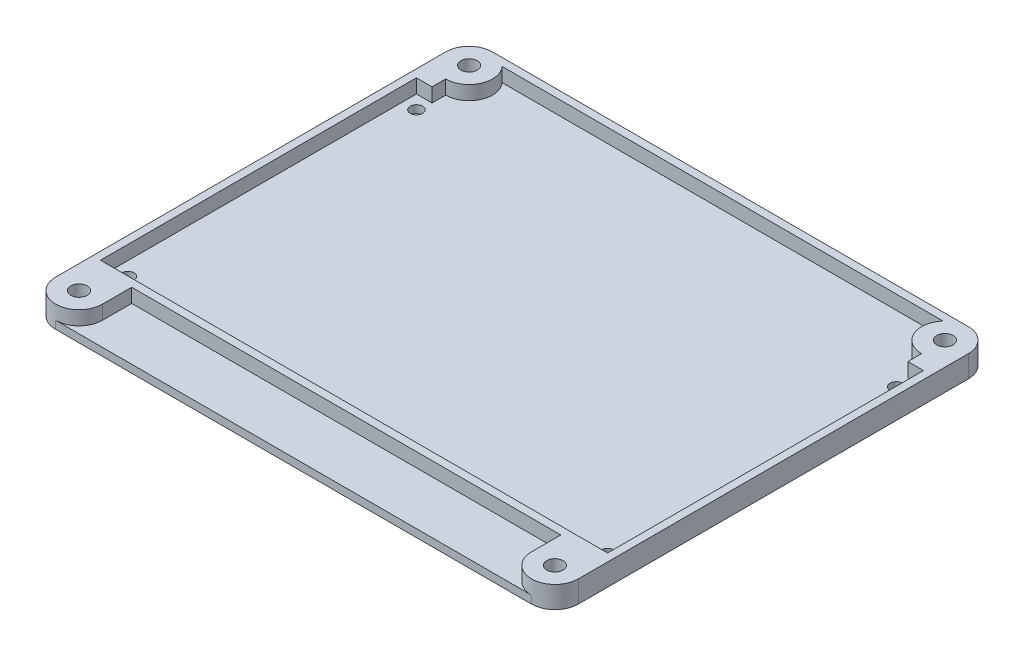
from build123d import *

# Parameters (mm, degrees)
SKETCH_1_W      = 129
SKETCH_1_H      = 80
SKETCH_1_R      = 1.6
EXTRUDE_1_DEPTH = 2
SKETCH_2_R      = 2.1
SKETCH_2_W      = 129
SKETCH_2_H      = 80
EXTRUDE_2_DEPTH = 2
EXTRUDE_START   = 3.6
SKETCH_3_R      = 2.1
EXTRUDE_3_DEPTH = 3.6
SKETCH_4_R      = 1.6
EXTRUDE_4_DEPTH = 3


with BuildPart() as part:
    # 草图1 → 凸台-拉伸1 (new body)
    with BuildSketch(Plane(origin=(0, 0, 0), x_dir=(1, 0, 0), z_dir=(0, 1, 0))):
        with Locations((96.776260997, 40)):
            Rectangle(SKETCH_1_W, SKETCH_1_H)
        with Locations(Location((35.276260997, 77, 0), (0, 0, 270))):
            Circle(SKETCH_1_R, mode=Mode.SUBTRACT)
        with Locations(Location((158.276260997, 77, 0), (0, 0, 270))):
            Circle(SKETCH_1_R, mode=Mode.SUBTRACT)
        with Locations(Location((158.276260997, 3, 0), (0, 0, 270))):
            Circle(SKETCH_1_R, mode=Mode.SUBTRACT)
        with Locations(Location((35.276260997, 3, 0), (0, 0, 270))):
            Circle(SKETCH_1_R, mode=Mode.SUBTRACT)
    extrude(amount=EXTRUDE_1_DEPTH)

    # 草图2 → 凸台-拉伸2 (add)
    with BuildSketch(Plane(origin=(0, 2, 0), x_dir=(1, 0, 0), z_dir=(0, 1, 0))):
        with BuildLine():
            Line((35.776260997, 96), (157.776260997, 96))
            ThreePointArc((157.776260997, 96), (162.018901684, 94.242640687), (163.776260997, 90))
            Line((163.776260997, 90), (163.776260997, -10))
            ThreePointArc((163.776260997, -10), (162.018901684, -14.242640687), (157.776260997, -16))
            Line((157.776260997, -16), (35.776260997, -16))
            ThreePointArc((35.776260997, -16), (31.53362031, -14.242640687), (29.776260997, -10))
            Line((29.776260997, -10), (29.776260997, 90))
            ThreePointArc((29.776260997, 90), (31.53362031, 94.242640687), (35.776260997, 96))
        make_face()
        with Locations(Location((35.776260997, -10, 0), (0, 0, 270))):
            Circle(SKETCH_2_R, mode=Mode.SUBTRACT)
        with Locations(Location((157.776260997, -10, 0), (0, 0, 90))):
            Circle(SKETCH_2_R, mode=Mode.SUBTRACT)
        with Locations(Location((157.776260997, 90, 0), (0, 0, 270))):
            Circle(SKETCH_2_R, mode=Mode.SUBTRACT)
        with Locations(Location((35.776260997, 90, 0), (0, 0, 90))):
            Circle(SKETCH_2_R, mode=Mode.SUBTRACT)
        with Locations((96.776260997, 40)):
            Rectangle(SKETCH_2_W, SKETCH_2_H, mode=Mode.SUBTRACT)
    extrude(amount=-EXTRUDE_2_DEPTH)

    # 草图3 → 凸台-拉伸3 (add)
    with BuildSketch(Plane(origin=(0, 2, 0), x_dir=(1, 0, 0), z_dir=(0, 1, 0)).offset(EXTRUDE_START)):
        with BuildLine():
            Line((41.776260997, -10), (41.776260997, -2.5))
            Line((41.776260997, -2.5), (151.776260997, -2.5))
            Line((151.776260997, -2.5), (151.776260997, -10))
            ThreePointArc((151.776260997, -10), (153.53362031, -14.242640687), (157.776260997, -16))
            ThreePointArc((157.776260997, -16), (162.018901684, -14.242640687), (163.776260997, -10))
            Line((163.776260997, -10), (163.776260997, 90))
            ThreePointArc((163.776260997, 90), (162.018901684, 94.242640687), (157.776260997, 96))
            Line((157.776260997, 96), (35.776260997, 96))
            ThreePointArc((35.776260997, 96), (31.53362031, 94.242640687), (29.776260997, 90))
            Line((29.776260997, 90), (29.776260997, -10))
            ThreePointArc((29.776260997, -10), (31.53362031, -14.242640687), (35.776260997, -16))
            ThreePointArc((35.776260997, -16), (40.018901684, -14.242640687), (41.776260997, -10))
        make_face()
        with Locations(Location((35.776260997, -10, 0), (0, 0, 270))):
            Circle(SKETCH_3_R, mode=Mode.SUBTRACT)
        with Locations(Location((35.776260997, 90, 0), (0, 0, 270))):
            Circle(SKETCH_3_R, mode=Mode.SUBTRACT)
        with Locations(Location((157.776260997, 90, 0), (0, 0, 270))):
            Circle(SKETCH_3_R, mode=Mode.SUBTRACT)
        with Locations(Location((157.776260997, -10, 0), (0, 0, 270))):
            Circle(SKETCH_3_R, mode=Mode.SUBTRACT)
        with BuildLine():
            Line((31.776260997, -0.5), (161.776260997, -0.5))
            Line((161.776260997, -0.5), (161.776260997, 80.5))
            Line((161.776260997, 80.5), (157.776260997, 80.5))
            Line((157.776260997, 80.5), (157.776260997, 84))
            ThreePointArc((157.776260997, 84), (152.299035422, 87.550510257), (153.304125042, 94))
            Line((153.304125042, 94), (96.776260997, 94))
            Line((96.776260997, 94), (40.248396952, 94))
            ThreePointArc((40.248396952, 94), (41.253486572, 87.550510257), (35.776260997, 84))
            Line((35.776260997, 84), (35.776260997, 80.5))
            Line((35.776260997, 80.5), (31.776260997, 80.5))
            Line((31.776260997, 80.5), (31.776260997, -0.5))
        make_face(mode=Mode.SUBTRACT)
    extrude(amount=-EXTRUDE_3_DEPTH)

    # 草图4 → 凸台-拉伸4 (add)
    # profile 1 of 4: a face of its own
    with BuildSketch(Plane.XZ):
        with BuildLine():
            Line((149.276260997, -80.2), (142.476260997, -80.2))
            Line((142.476260997, -80.2), (136.976260997, -85.7))
            Line((136.976260997, -85.7), (136.976260997, -92.5))
            Line((136.976260997, -92.5), (142.776260997, -92.5))
            ThreePointArc((142.776260997, -92.5), (147.372455074, -90.596194078), (149.276260997, -86))
            Line((149.276260997, -86), (149.276260997, -80.2))
        make_face()
        with Locations(Location((142.776260997, -86, 0), (0, 0, 270))):
            Circle(SKETCH_4_R, mode=Mode.SUBTRACT)
    # profile 2 of 4: a face of its own
    with BuildSketch(Plane.XZ):
        with BuildLine():
            Line((56.576260997, -92.5), (50.776260997, -92.5))
            ThreePointArc((50.776260997, -92.5), (46.180066919, -90.596194078), (44.276260997, -86))
            Line((44.276260997, -86), (44.276260997, -80.2))
            Line((44.276260997, -80.2), (51.076260997, -80.2))
            Line((51.076260997, -80.2), (56.576260997, -85.7))
            Line((56.576260997, -85.7), (56.576260997, -92.5))
        make_face()
        with Locations(Location((50.776260997, -86, 0), (0, 0, 270))):
            Circle(SKETCH_4_R, mode=Mode.SUBTRACT)
    # profile 3 of 4: a face of its own
    with BuildSketch(Plane.XZ):
        with BuildLine():
            Line((136.976260997, 12.5), (142.776260997, 12.5))
            ThreePointArc((142.776260997, 12.5), (147.372455074, 10.596194078), (149.276260997, 6))
            Line((149.276260997, 6), (149.276260997, 0.2))
            Line((149.276260997, 0.2), (142.476260997, 0.2))
            Line((142.476260997, 0.2), (136.976260997, 5.7))
            Line((136.976260997, 5.7), (136.976260997, 12.5))
        make_face()
        with Locations(Location((142.776260997, 6, 0), (0, 0, 270))):
            Circle(SKETCH_4_R, mode=Mode.SUBTRACT)
    # profile 4 of 4: a face of its own
    with BuildSketch(Plane.XZ):
        with BuildLine():
            Line((44.276260997, 0.2), (51.076260997, 0.2))
            Line((51.076260997, 0.2), (56.576260997, 5.7))
            Line((56.576260997, 5.7), (56.576260997, 12.5))
            Line((56.576260997, 12.5), (50.776260997, 12.5))
            ThreePointArc((50.776260997, 12.5), (46.180066919, 10.596194078), (44.276260997, 6))
            Line((44.276260997, 6), (44.276260997, 0.2))
        make_face()
        with Locations(Location((50.776260997, 6, 0), (0, 0, 270))):
            Circle(SKETCH_4_R, mode=Mode.SUBTRACT)
    extrude(amount=EXTRUDE_4_DEPTH)


solid = part.part
